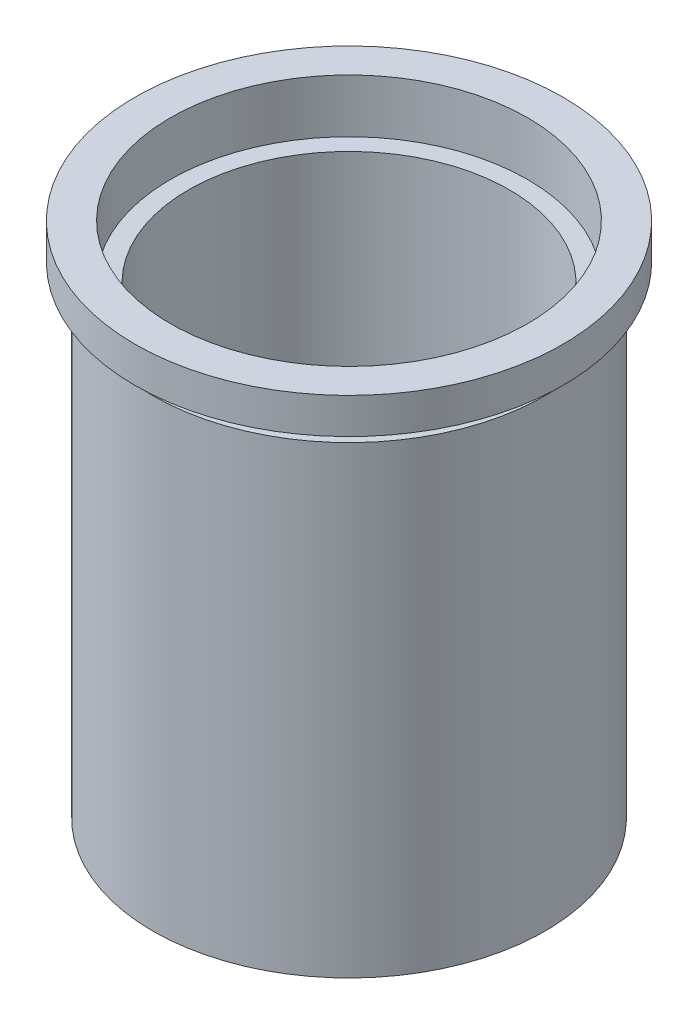
from build123d import *

# Parameters (mm, degrees)
SKETCH_2_R           = 10.01
SKETCH_2_R_2         = 9
EXTRUDE_2_DEPTH      = 25
EXTRUDE_START        = 2
SKETCH_3_R           = 10.01
EXTRUDE_3_DEPTH      = 2
SKETCH_4_R           = 9
CUT_EXTRUDE_1_DEPTH  = 1
SKETCH_6_R           = 8
CUT_EXTRUDE_3_DEPTH  = 3
SKETCH_7_R           = 11
SKETCH_7_R_2         = 10
EXTRUDE_4_DEPTH      = 4
SKETCH_8_R           = 9
SKETCH_8_R_2         = 8
EXTRUDE_5_DEPTH      = 25
SKETCH_10_R          = 10.01
SKETCH_10_R_2        = 9.5
CUT_EXTRUDE_5_DEPTH  = 1
CUT_EXTRUDE_START    = 10
SKETCH_11_R          = 10.01
CUT_EXTRUDE_6_DEPTH  = 10
SKETCH_12_R          = 11
SKETCH_12_R_2        = 10.01
EXTRUDE_6_DEPTH      = 26
SKETCH_13_R          = 9
CUT_EXTRUDE_7_DEPTH  = 26
SKETCH_14_R          = 10.005206388
SKETCH_14_R_2        = 9.5
EXTRUDE_7_DEPTH      = 26
SKETCH_16_R          = 11
SKETCH_16_R_2        = 10.5
CUT_EXTRUDE_12_DEPTH = 1
SKETCH_17_R          = 13.732639959
CUT_EXTRUDE_13_DEPTH = 1
SKETCH_19_R          = 10.229377856
SKETCH_19_R_2        = 10.005206388
EXTRUDE_10_DEPTH     = 10
SKETCH_20_R          = 12
SKETCH_20_R_2        = 11
EXTRUDE_11_DEPTH     = 2


with BuildPart() as part:
    # Эскиз2 → Бобышка-Вытянуть2 (new body)
    with BuildSketch(Plane.XZ):
        with Locations(Location((0, 0, 0), (0, 0, 270))):
            Circle(SKETCH_2_R)
        with Locations(Location((0, 0, 0), (0, 0, 270))):
            Circle(SKETCH_2_R_2, mode=Mode.SUBTRACT)
    extrude(amount=EXTRUDE_2_DEPTH)

    # Эскиз3 → Бобышка-Вытянуть3 (add)
    with BuildSketch(Plane(origin=(0, 0, 0), x_dir=(1, 0, 0), z_dir=(0, 1, 0)).offset(EXTRUDE_START)):
        with Locations(Location((0, 0, 0), (0, 0, 270))):
            Circle(SKETCH_3_R)
    extrude(amount=-EXTRUDE_3_DEPTH)

    # Эскиз4 → Вырез-Вытянуть1 (cut)
    with BuildSketch(Plane(origin=(0, 2, 0), x_dir=(1, 0, 0), z_dir=(0, 1, 0))):
        with Locations(Location((0, 0, 0), (0, 0, 90))):
            Circle(SKETCH_4_R)
    extrude(amount=-CUT_EXTRUDE_1_DEPTH, mode=Mode.SUBTRACT)

    # Эскиз6 → Вырез-Вытянуть3 (cut)
    with BuildSketch(Plane(origin=(0, 1, 0), x_dir=(1, 0, 0), z_dir=(0, 1, 0))):
        with Locations(Location((0, 0, 0), (0, 0, 270))):
            Circle(SKETCH_6_R)
    extrude(amount=-CUT_EXTRUDE_3_DEPTH, mode=Mode.SUBTRACT)

    # Эскиз7 → Бобышка-Вытянуть4 (add)
    with BuildSketch(Plane(origin=(0, 1, 0), x_dir=(1, 0, 0), z_dir=(0, 1, 0))):
        with Locations(Location((0, 0, 0), (0, 0, 270))):
            Circle(SKETCH_7_R)
        with Locations(Location((0, 0, 0), (0, 0, 270))):
            Circle(SKETCH_7_R_2, mode=Mode.SUBTRACT)
    extrude(amount=EXTRUDE_4_DEPTH)

    # Эскиз8 → Бобышка-Вытянуть5 (add)
    with BuildSketch(Plane.XZ):
        with Locations(Location((0, 0, 0), (0, 0, 90))):
            Circle(SKETCH_8_R)
        with Locations(Location((0, 0, 0), (0, 0, 90))):
            Circle(SKETCH_8_R_2, mode=Mode.SUBTRACT)
    extrude(amount=EXTRUDE_5_DEPTH)

    # Эскиз10 → Вырез-Вытянуть5 (cut)
    with BuildSketch(Plane.XZ.offset(-1)):
        with Locations(Location((0, 0, 0), (0, 0, 270))):
            Circle(SKETCH_10_R)
        with Locations(Location((0, 0, 0), (0, 0, 270))):
            Circle(SKETCH_10_R_2, mode=Mode.SUBTRACT)
    extrude(amount=CUT_EXTRUDE_5_DEPTH, mode=Mode.SUBTRACT)

    # Эскиз11 → Вырез-Вытянуть6 (cut)
    with BuildSketch(Plane(origin=(0, 1, 0), x_dir=(1, 0, 0), z_dir=(0, 1, 0)).offset(CUT_EXTRUDE_START)):
        with Locations(Location((0, 0, 0), (0, 0, 90))):
            Circle(SKETCH_11_R)
    extrude(amount=-CUT_EXTRUDE_6_DEPTH, mode=Mode.SUBTRACT)


with BuildPart() as cut_extrude_6_piece_1:
    # of the separate pieces the step leaves, piece 1, a body of its own (cut_extrude_6_pieces)
    add(part.part.solids().sort_by_distance((0, 0, -10.01))[0])



with BuildPart() as cut_extrude_6_piece_2:
    # of the separate pieces the step leaves, piece 2, a body of its own (cut_extrude_6_pieces)
    add(part.part.solids().sort_by_distance((0, 1, 11))[0])


with BuildPart() as cut_extrude_6_piece_1_1:
    add(cut_extrude_6_piece_1.part)

    add(cut_extrude_6_piece_2.part)  # Бобышка-Вытянуть6 merges Вырез-Вытянуть6 piece 2
    # Эскиз12 → Бобышка-Вытянуть6 (add)
    with BuildSketch(Plane.XZ.offset(25)):
        with Locations(Location((0, 0, 0), (0, 0, 270))):
            Circle(SKETCH_12_R)
        with Locations(Location((0, 0, 0), (0, 0, 270))):
            Circle(SKETCH_12_R_2, mode=Mode.SUBTRACT)
    extrude(amount=-EXTRUDE_6_DEPTH)

    # Эскиз13 → Вырез-Вытянуть7 (cut)
    with BuildSketch(Plane(origin=(0, 1, 0), x_dir=(1, 0, 0), z_dir=(0, 1, 0))):
        with Locations(Location((0, 0, 0), (0, 0, 270))):
            Circle(SKETCH_13_R)
    extrude(amount=-CUT_EXTRUDE_7_DEPTH, mode=Mode.SUBTRACT)

    # Эскиз14 → Бобышка-Вытянуть7 (add)
    with BuildSketch(Plane(origin=(0, 1, 0), x_dir=(1, 0, 0), z_dir=(0, 1, 0))):
        with Locations(Location((0, 0, 0), (0, 0, 270))):
            Circle(SKETCH_14_R)
        Circle(SKETCH_14_R_2, mode=Mode.SUBTRACT)
    extrude(amount=-EXTRUDE_7_DEPTH)

    # Эскиз16 → Вырез-Вытянуть12 (cut)
    with BuildSketch(Plane.XZ.offset(-2)):
        with Locations(Location((0, 0, 0), (0, 0, 270))):
            Circle(SKETCH_16_R)
        with Locations(Location((0, 0, 0), (0, 0, 270))):
            Circle(SKETCH_16_R_2, mode=Mode.SUBTRACT)
    extrude(amount=CUT_EXTRUDE_12_DEPTH, mode=Mode.SUBTRACT)

    # Эскиз17 → Вырез-Вытянуть13 (cut)
    with BuildSketch(Plane(origin=(0, 5, 0), x_dir=(1, 0, 0), z_dir=(0, 1, 0))):
        Circle(SKETCH_17_R)
    extrude(amount=-CUT_EXTRUDE_13_DEPTH, mode=Mode.SUBTRACT)

    # Эскиз19 → Бобышка-Вытянуть10 (add)
    with BuildSketch(Plane(origin=(0, 1, 0), x_dir=(1, 0, 0), z_dir=(0, 1, 0))):
        Circle(SKETCH_19_R)
        Circle(SKETCH_19_R_2, mode=Mode.SUBTRACT)
    extrude(amount=-EXTRUDE_10_DEPTH)

    # Эскиз20 → Бобышка-Вытянуть11 (add)
    with BuildSketch(Plane(origin=(0, 4, 0), x_dir=(1, 0, 0), z_dir=(0, 1, 0))):
        with Locations(Location((0, 0, 0), (0, 0, 270))):
            Circle(SKETCH_20_R)
        with Locations(Location((0, 0, 0), (0, 0, 90))):
            Circle(SKETCH_20_R_2, mode=Mode.SUBTRACT)
    extrude(amount=-EXTRUDE_11_DEPTH)


solid = cut_extrude_6_piece_1_1.part
